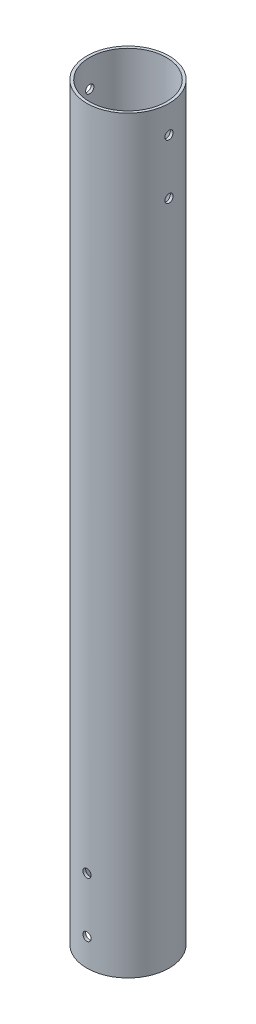
from build123d import *

# Parameters (mm, degrees)
SKETCH_1_R               = 15
EXTRUDE_1_DEPTH          = 273
CUT_EXTRUDE_1_DEPTH      = 274.822935489
CUT_EXTRUDE_1_DEPTH_BACK = 274.822935489
SKETCH_2_R               = 1.5
CUT_EXTRUDE_2_DEPTH      = 274.8229356
CUT_EXTRUDE_2_DEPTH_BACK = 274.8229356
SKETCH_3_R               = 1.5
CUT_EXTRUDE_3_REACH      = 275.823
SKETCH_4_R               = 14


with BuildPart() as part:
    # 草圖1 → 填料-伸長1 (new body)
    with BuildSketch(Plane(origin=(0, 0, 0), x_dir=(1, 0, 0), z_dir=(0, 1, 0))):
        with Locations(Location((0, 0, 0), (0, 0, 270))):
            Circle(SKETCH_1_R)
    extrude(amount=EXTRUDE_1_DEPTH)

    # 草圖2 → 除料-伸長1 (cut, two sides: drawn at the far end of the back side and taken through both)
    with BuildSketch(Plane.XY.offset(-CUT_EXTRUDE_1_DEPTH_BACK)):
        with Locations((0, 10)):
            Circle(SKETCH_2_R)
        with Locations((0, 30)):
            Circle(SKETCH_2_R)
    extrude(amount=CUT_EXTRUDE_1_DEPTH + CUT_EXTRUDE_1_DEPTH_BACK, mode=Mode.SUBTRACT)

    # 草圖3 → 除料-伸長2 (cut, two sides: drawn at the far end of the back side and taken through both)
    with BuildSketch(Plane(origin=(0, 0, 0), x_dir=(0, 0, -1), z_dir=(1, 0, 0)).offset(-CUT_EXTRUDE_2_DEPTH_BACK)):
        with Locations((0, 263)):
            Circle(SKETCH_3_R)
        with Locations((0, 243)):
            Circle(SKETCH_3_R)
    extrude(amount=CUT_EXTRUDE_2_DEPTH + CUT_EXTRUDE_2_DEPTH_BACK, mode=Mode.SUBTRACT)

    # 草圖4 → 除料-伸長3 (cut, up to next)
    with BuildSketch(Plane(origin=(0, 273, 0), x_dir=(1, 0, 0), z_dir=(0, 1, 0)), mode=Mode.PRIVATE) as cut_extrude_3_sk1:
        with Locations(Location((0, 0, 0), (0, 0, 270))):
            Circle(SKETCH_4_R)
    cut_extrude_3_tool1 = extrude(cut_extrude_3_sk1.sketch, amount=-CUT_EXTRUDE_3_REACH, mode=Mode.PRIVATE) & part.part
    add(cut_extrude_3_tool1.solids().sort_by_distance((0, 273, 0))[0], mode=Mode.SUBTRACT)


solid = part.part
